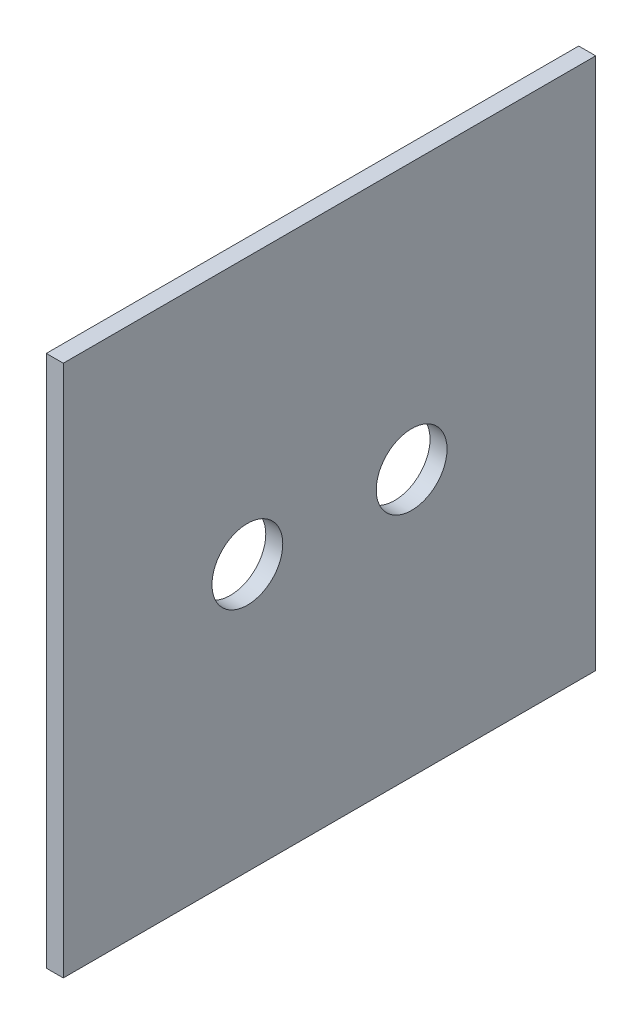
from build123d import *

# Parameters (mm, degrees)
SKETCH1_W           = 188
SKETCH1_H           = 188
SKETCH1_R           = 12.5
BOSS_EXTRUDE1_DEPTH = 6


with BuildPart() as part:
    # Sketch1 → Boss-Extrude1 (new body)
    with BuildSketch(Plane(origin=(0, 0, 0), x_dir=(0, 0, -1), z_dir=(1, 0, 0))):
        with Locations((13.282608696, 27.45923913)):
            Rectangle(SKETCH1_W, SKETCH1_H)
        with Locations((42.282608696, 27.45923913)):
            Circle(SKETCH1_R, mode=Mode.SUBTRACT)
        with Locations((-15.717391304, 27.45923913)):
            Circle(SKETCH1_R, mode=Mode.SUBTRACT)
    extrude(amount=BOSS_EXTRUDE1_DEPTH)


solid = part.part
